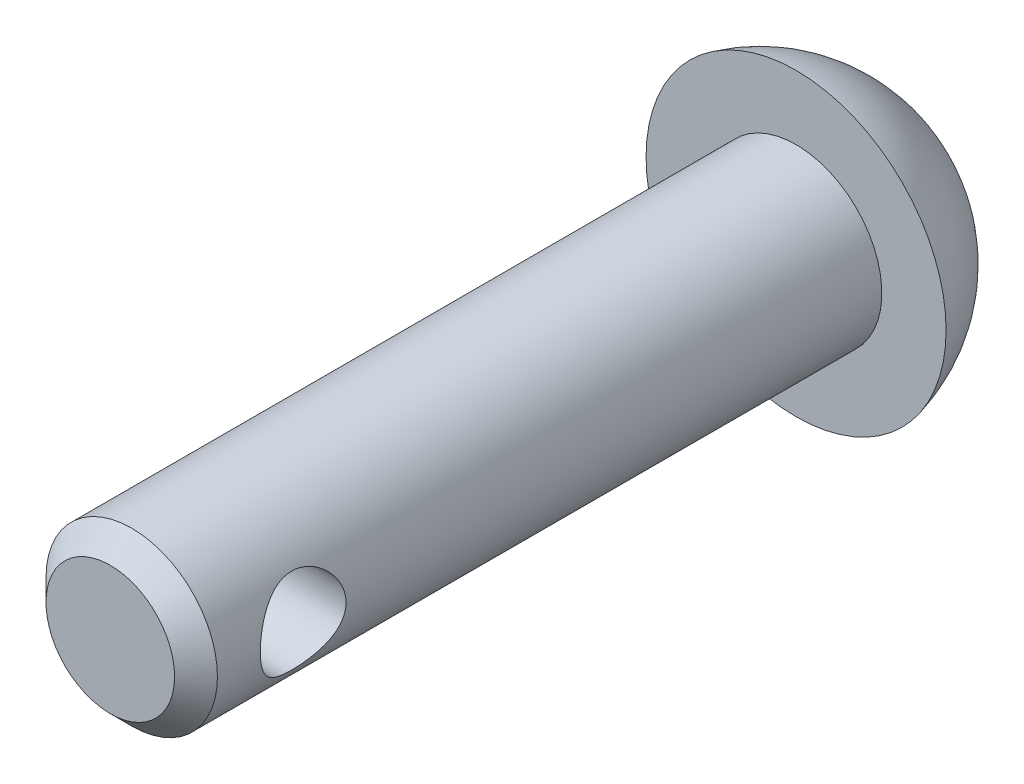
from build123d import *

# Parameters (mm, degrees)
SKETCH1_R               = 2
BOSS_EXTRUDE1_DEPTH     = 8
CUT_EXTRUDE2_DEPTH      = 12.841508879
CUT_EXTRUDE2_DEPTH_BACK = 12.841508879
SKETCH3_R               = 1
CHAMFER1_SIZE           = 0.5


with BuildPart() as part:
    # Sketch1 → Boss-Extrude1 (new, symmetric)
    with BuildSketch(Plane.XY):
        Circle(SKETCH1_R)
    extrude(amount=BOSS_EXTRUDE1_DEPTH, both=True)

    # Sketch2 → Revolve1 (revolve)
    with BuildSketch(Plane(origin=(0, 0, 0), x_dir=(0, 0, -1), z_dir=(1, 0, 0)), mode=Mode.PRIVATE) as revolve1_sk:
        with BuildLine():
            Line((8, 3.5), (8, 0))
            Line((8, 0), (10.757385023, 0))
            ThreePointArc((10.757385023, 0), (9.985229955, 2.227844932), (8, 3.5))
        make_face()
    revolve(revolve1_sk.sketch.rotate(Axis((0, 0, -5.831094732), (0, 0, -1)), 270), axis=Axis((0, 0, -5.831094732), (0, 0, -1)))

    # Sketch3 → Cut-Extrude2 (cut, two sides: drawn at the far end of the back side and taken through both)
    with BuildSketch(Plane(origin=(0, 0, 0), x_dir=(0, 0, -1), z_dir=(1, 0, 0)).offset(-CUT_EXTRUDE2_DEPTH_BACK)):
        with Locations((-5.5, 0)):
            Circle(SKETCH3_R)
    extrude(amount=CUT_EXTRUDE2_DEPTH + CUT_EXTRUDE2_DEPTH_BACK, mode=Mode.SUBTRACT)

    # Chamfer1
    chamfer1_edges = [part.edges().sort_by_distance(p)[0] for p in [
        (-2, 0, 8),
    ]]
    chamfer(chamfer1_edges, length=CHAMFER1_SIZE)


solid = part.part
